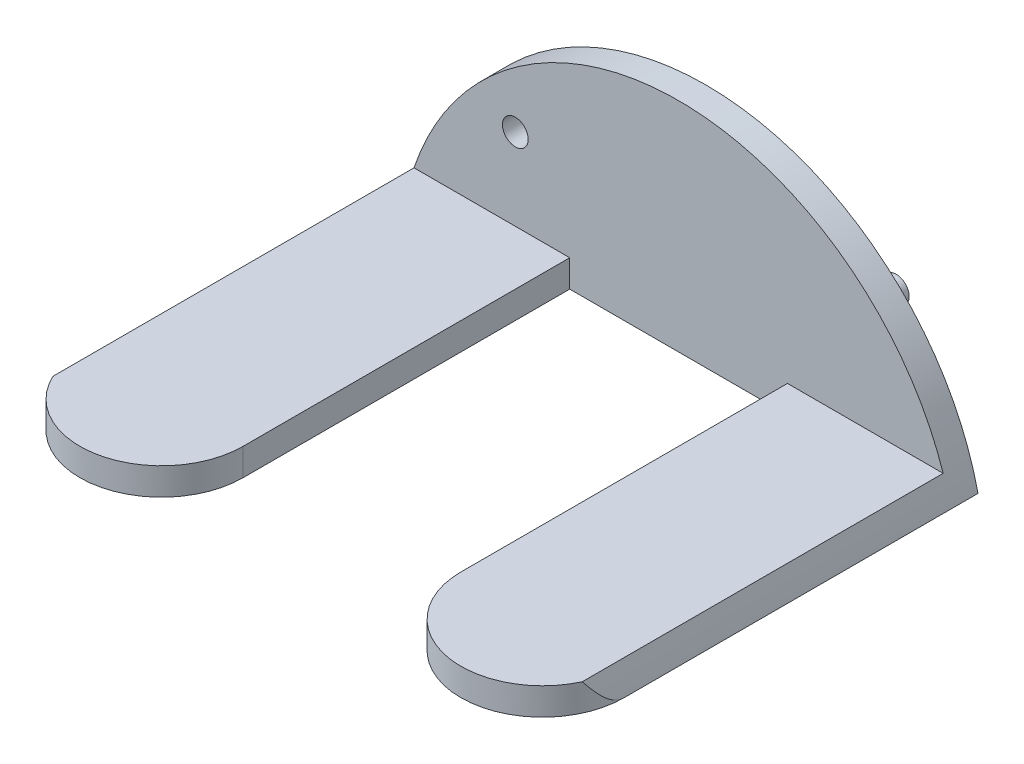
from build123d import *

# Parameters (mm, degrees)
BOSS_EXTRUDE1_DEPTH = 63.5
SKETCH3_R           = 1.5
CUT_EXTRUDE1_DEPTH  = 86.194189943
SKETCH3_3_R         = 1.5
BOSS_EXTRUDE2_DEPTH = 3.175
CUT_EXTRUDE2_DEPTH  = 86.194189943
CUT_EXTRUDE3_DEPTH  = 3.175


with BuildPart() as part:
    # Sketch2 → Boss-Extrude1 (new body)
    with BuildSketch(Plane(origin=(0, 0, 0), x_dir=(0, 0, -1), z_dir=(1, 0, 0))):
        Polygon((-50.8, 0), (0, 0), (0, 25.4), (-3.175, 25.4), (-3.175, 3.175), (-50.8, 3.175), align=None)
    extrude(amount=BOSS_EXTRUDE1_DEPTH)

    # Sketch3 → Cut-Extrude1 (cut, through all)
    with BuildSketch(Plane(origin=(0, 0, 0), x_dir=(-1, 0, 0), z_dir=(0, 0, -1))):
        with Locations((-12.7, 12.7)):
            Circle(SKETCH3_R)
    extrude(amount=-CUT_EXTRUDE1_DEPTH, mode=Mode.SUBTRACT)

    # Sketch3<3> → Boss-Extrude2 (add)
    with BuildSketch(Plane(origin=(0, 0, 0), x_dir=(-1, 0, 0), z_dir=(0, 0, -1))):
        with Locations((-50.8, 12.7)):
            Circle(SKETCH3_3_R)
    extrude(amount=BOSS_EXTRUDE2_DEPTH)

    # Sketch4 → Cut-Extrude2 (cut, through all)
    with BuildSketch(Plane(origin=(0, 0, 0), x_dir=(-1, 0, 0), z_dir=(0, 0, -1))):
        with BuildLine():
            Line((-63.5, 25.4), (-63.5, 0))
            ThreePointArc((-63.5, 0), (-52.079919454, 18.268649317), (-31.75, 25.4))
            Line((-31.75, 25.4), (-63.5, 25.4))
        make_face()
        with BuildLine():
            ThreePointArc((-31.75, 25.4), (-11.420080546, 18.268649317), (0, 0))
            Line((0, 0), (0, 25.4))
            Line((0, 25.4), (-31.75, 25.4))
        make_face()
    extrude(amount=-CUT_EXTRUDE2_DEPTH, mode=Mode.SUBTRACT)

    # Sketch5 → Cut-Extrude3 (cut)
    with BuildSketch(Plane(origin=(0, 3.175, 0), x_dir=(1, 0, 0), z_dir=(0, 1, 0))):
        with BuildLine():
            Line((0, -41.275), (0, -50.8))
            Line((0, -50.8), (9.525, -50.8))
            ThreePointArc((9.525, -50.8), (2.789807909, -48.010192091), (0, -41.275))
        make_face()
        with BuildLine():
            Line((44.45, -3.175), (19.05, -3.175))
            Line((19.05, -3.175), (19.05, -41.275))
            ThreePointArc((19.05, -41.275), (16.260192091, -48.010192091), (9.525, -50.8))
            Line((9.525, -50.8), (53.975, -50.8))
            ThreePointArc((53.975, -50.8), (47.239807909, -48.010192091), (44.45, -41.275))
            Line((44.45, -41.275), (44.45, -3.175))
        make_face()
        with BuildLine():
            Line((53.975, -50.8), (63.5, -50.8))
            Line((63.5, -50.8), (63.5, -41.275))
            ThreePointArc((63.5, -41.275), (60.710192091, -48.010192091), (53.975, -50.8))
        make_face()
    extrude(amount=-CUT_EXTRUDE3_DEPTH, mode=Mode.SUBTRACT)


solid = part.part
